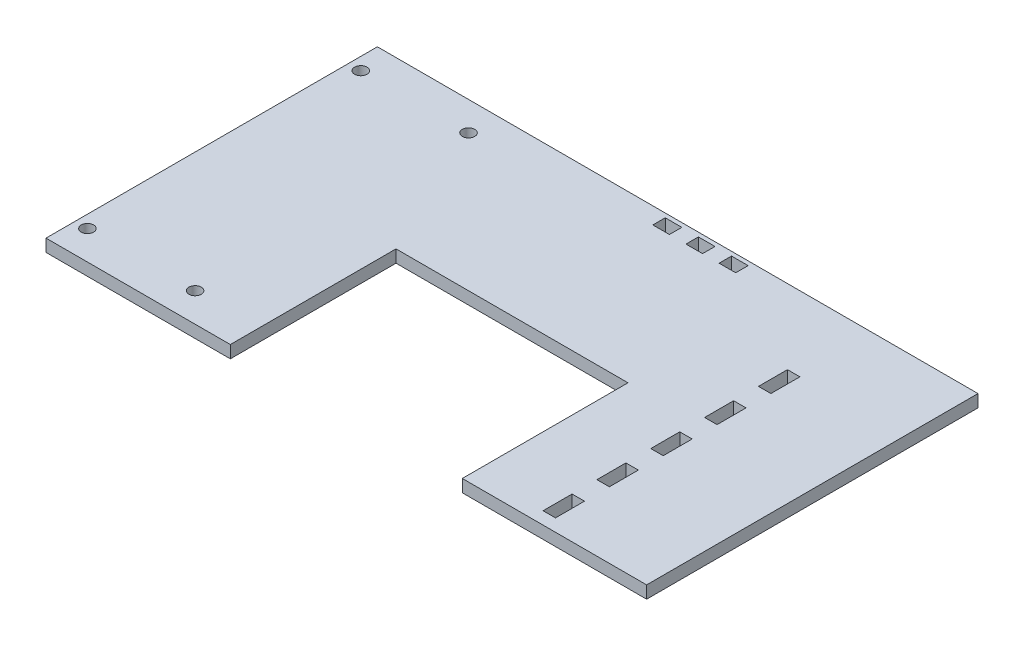
from build123d import *

# Parameters (mm, degrees)
SKETCH1_R           = 1.5
SKETCH1_W           = 3
SKETCH1_H           = 7
SKETCH1_W_2         = 4
SKETCH1_H_2         = 3
BOSS_EXTRUDE1_DEPTH = 3


with BuildPart() as part:
    # Sketch1 → Boss-Extrude1 (new body)
    with BuildSketch(Plane(origin=(0, 0, 0), x_dir=(1, 0, 0), z_dir=(0, 1, 0))):
        Polygon((-72.5, -40), (-28, -40), (-28, 0), (28, 0), (28, -40), (72.5, -40), (72.5, 40), (-72.5, 40), align=None)
        with Locations(Location((-69.5, 33, 0), (0, 0, 270))):
            Circle(SKETCH1_R, mode=Mode.SUBTRACT)
        with Locations(Location((-43.5, 33, 0), (0, 0, 270))):
            Circle(SKETCH1_R, mode=Mode.SUBTRACT)
        with Locations(Location((-43.5, -33, 0), (0, 0, 270))):
            Circle(SKETCH1_R, mode=Mode.SUBTRACT)
        with Locations(Location((-69.5, -33, 0), (0, 0, 270))):
            Circle(SKETCH1_R, mode=Mode.SUBTRACT)
        with Locations((46, 5.5)):
            Rectangle(SKETCH1_W, SKETCH1_H, mode=Mode.SUBTRACT)
        with Locations((46, 18.5)):
            Rectangle(SKETCH1_W, SKETCH1_H, mode=Mode.SUBTRACT)
        with Locations((46, -7.5)):
            Rectangle(SKETCH1_W, SKETCH1_H, mode=Mode.SUBTRACT)
        with Locations((46, -20.5)):
            Rectangle(SKETCH1_W, SKETCH1_H, mode=Mode.SUBTRACT)
        with Locations((46, -33.5)):
            Rectangle(SKETCH1_W, SKETCH1_H, mode=Mode.SUBTRACT)
        with Locations((0, 37.5)):
            Rectangle(SKETCH1_W_2, SKETCH1_H_2, mode=Mode.SUBTRACT)
        with Locations((8, 37.5)):
            Rectangle(SKETCH1_W_2, SKETCH1_H_2, mode=Mode.SUBTRACT)
        with Locations((16, 37.5)):
            Rectangle(SKETCH1_W_2, SKETCH1_H_2, mode=Mode.SUBTRACT)
    extrude(amount=BOSS_EXTRUDE1_DEPTH)


solid = part.part
